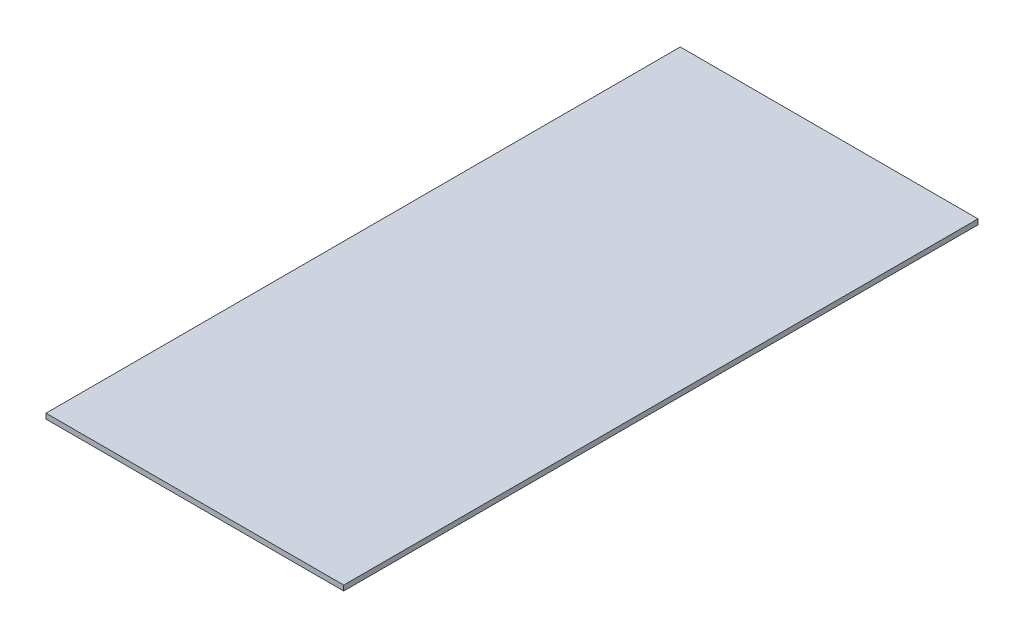
from build123d import *

# Parameters (mm, degrees)
SKETCH1_W           = 460
SKETCH1_H           = 980
BOSS_EXTRUDE1_DEPTH = 4


with BuildPart() as part:
    # Sketch1 → Boss-Extrude1 (new, symmetric)
    with BuildSketch(Plane(origin=(0, 0, 0), x_dir=(1, 0, 0), z_dir=(0, 1, 0))):
        Rectangle(SKETCH1_W, SKETCH1_H)
    extrude(amount=BOSS_EXTRUDE1_DEPTH, both=True)


solid = part.part
